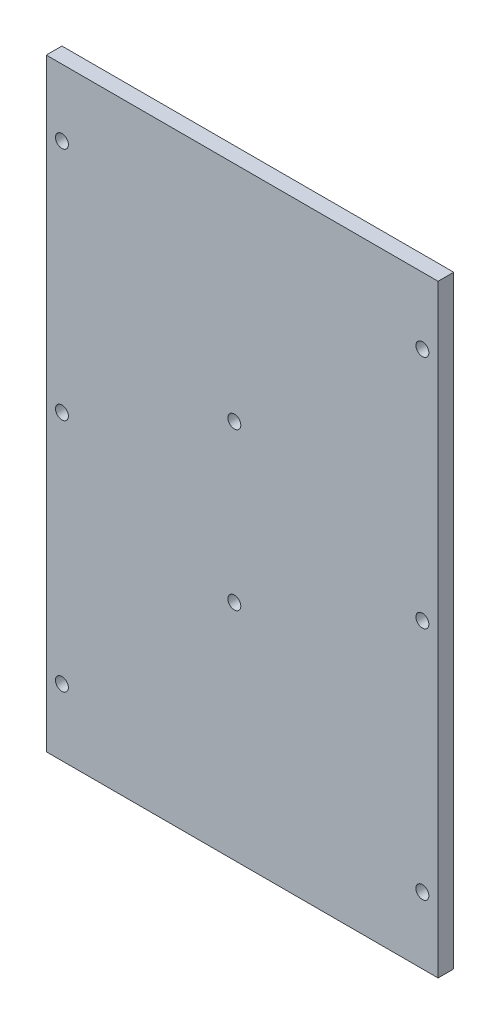
from build123d import *

# Parameters (mm, degrees)
SKETCH1_W                     = 154
SKETCH1_H                     = 100
BOSS_EXTRUDE1_DEPTH           = 4
SKETCH2_R                     = 1.65
CUT_EXTRUDE1_DEPTH            = 184.66273438
SKETCH3_R                     = 7.5
BOSS_EXTRUDE2_DEPTH           = 6
BOSS_EXTRUDE2_DRAFT           = 15
BOSS_EXTRUDE2_PROFILE_2_DEPTH = 6
BOSS_EXTRUDE2_PROFILE_2_DRAFT = 15
BOSS_EXTRUDE2_PROFILE_3_DEPTH = 6
BOSS_EXTRUDE2_PROFILE_3_DRAFT = 15
BOSS_EXTRUDE2_PROFILE_4_DEPTH = 6
BOSS_EXTRUDE2_PROFILE_4_DRAFT = 15
SKETCH4_R                     = 3
CUT_EXTRUDE2_DEPTH            = 1.5


with BuildPart() as part:
    # Sketch1 → Boss-Extrude1 (new body)
    with BuildSketch(Plane(origin=(0, 0, 0), x_dir=(0, 1, 0), z_dir=(0, 0, 1))):
        with Locations((77, 50)):
            Rectangle(SKETCH1_W, SKETCH1_H)
    extrude(amount=BOSS_EXTRUDE1_DEPTH)

    # Sketch2 → Cut-Extrude1 (cut, through all)
    with BuildSketch(Plane(origin=(0, 0, 0), x_dir=(1, 0, 0), z_dir=(0, 0, -1))):
        with Locations(Location((-4, -77, 0), (0, 0, 180))):
            Circle(SKETCH2_R)
        with Locations(Location((-4, -17, 0), (0, 0, 180))):
            Circle(SKETCH2_R)
        with Locations(Location((-4, -137, 0), (0, 0, 180))):
            Circle(SKETCH2_R)
        with Locations(Location((-96, -137, 0), (0, 0, 180))):
            Circle(SKETCH2_R)
        with Locations(Location((-96, -77, 0), (0, 0, 180))):
            Circle(SKETCH2_R)
        with Locations(Location((-96, -17, 0), (0, 0, 180))):
            Circle(SKETCH2_R)
        with Locations(Location((-52, -97, 0), (0, 0, 180))):
            Circle(SKETCH2_R)
        with Locations(Location((-52, -57, 0), (0, 0, 180))):
            Circle(SKETCH2_R)
    extrude(amount=-CUT_EXTRUDE1_DEPTH, mode=Mode.SUBTRACT)


with BuildPart() as boss_extrude2_tool:
    # Sketch3 → Boss-Extrude2 (with draft: the straight prism first)
    with BuildSketch(Plane(origin=(0, 0, 0), x_dir=(1, 0, 0), z_dir=(0, 0, -1))):
        with Locations((-85, -15)):
            Circle(SKETCH3_R)
    extrude(amount=BOSS_EXTRUDE2_DEPTH)
    # Boss-Extrude2: the draft: its side faces are tilted about the plane it starts from
    boss_extrude2_sides = [boss_extrude2_tool.faces().sort_by_distance(p)[0] for p in [
        (-92.5, 15, -3),
    ]]
    draft(boss_extrude2_sides, Plane(origin=(0, 0, 0), x_dir=(1, 0, 0), z_dir=(0, 0, -1)), BOSS_EXTRUDE2_DRAFT)


with BuildPart() as part_1:
    add(part.part)

    # Boss-Extrude2: add boss_extrude2_tool
    add(boss_extrude2_tool.part)


with BuildPart() as boss_extrude2_profile_2_tool:
    # Sketch3 → Boss-Extrude2 profile 2 (with draft: the straight prism first)
    with BuildSketch(Plane(origin=(0, 0, 0), x_dir=(1, 0, 0), z_dir=(0, 0, -1))):
        with Locations((-15, -15)):
            Circle(SKETCH3_R)
    extrude(amount=BOSS_EXTRUDE2_PROFILE_2_DEPTH)
    # Boss-Extrude2 profile 2: the draft: its side faces are tilted about the plane it starts from
    boss_extrude2_profile_2_sides = [boss_extrude2_profile_2_tool.faces().sort_by_distance(p)[0] for p in [
        (-22.5, 15, -3),
    ]]
    draft(boss_extrude2_profile_2_sides, Plane(origin=(0, 0, 0), x_dir=(1, 0, 0), z_dir=(0, 0, -1)), BOSS_EXTRUDE2_PROFILE_2_DRAFT)


with BuildPart() as part_2:
    add(part_1.part)

    # Boss-Extrude2 profile 2: add boss_extrude2_profile_2_tool
    add(boss_extrude2_profile_2_tool.part)


with BuildPart() as boss_extrude2_profile_3_tool:
    # Sketch3 → Boss-Extrude2 profile 3 (with draft: the straight prism first)
    with BuildSketch(Plane(origin=(0, 0, 0), x_dir=(1, 0, 0), z_dir=(0, 0, -1))):
        with Locations((-15, -139)):
            Circle(SKETCH3_R)
    extrude(amount=BOSS_EXTRUDE2_PROFILE_3_DEPTH)
    # Boss-Extrude2 profile 3: the draft: its side faces are tilted about the plane it starts from
    boss_extrude2_profile_3_sides = [boss_extrude2_profile_3_tool.faces().sort_by_distance(p)[0] for p in [
        (-22.5, 139, -3),
    ]]
    draft(boss_extrude2_profile_3_sides, Plane(origin=(0, 0, 0), x_dir=(1, 0, 0), z_dir=(0, 0, -1)), BOSS_EXTRUDE2_PROFILE_3_DRAFT)


with BuildPart() as part_3:
    add(part_2.part)

    # Boss-Extrude2 profile 3: add boss_extrude2_profile_3_tool
    add(boss_extrude2_profile_3_tool.part)


with BuildPart() as boss_extrude2_profile_4_tool:
    # Sketch3 → Boss-Extrude2 profile 4 (with draft: the straight prism first)
    with BuildSketch(Plane(origin=(0, 0, 0), x_dir=(1, 0, 0), z_dir=(0, 0, -1))):
        with Locations((-85, -139)):
            Circle(SKETCH3_R)
    extrude(amount=BOSS_EXTRUDE2_PROFILE_4_DEPTH)
    # Boss-Extrude2 profile 4: the draft: its side faces are tilted about the plane it starts from
    boss_extrude2_profile_4_sides = [boss_extrude2_profile_4_tool.faces().sort_by_distance(p)[0] for p in [
        (-92.5, 139, -3),
    ]]
    draft(boss_extrude2_profile_4_sides, Plane(origin=(0, 0, 0), x_dir=(1, 0, 0), z_dir=(0, 0, -1)), BOSS_EXTRUDE2_PROFILE_4_DRAFT)


with BuildPart() as part_4:
    add(part_3.part)

    # Boss-Extrude2 profile 4: add boss_extrude2_profile_4_tool
    add(boss_extrude2_profile_4_tool.part)

    # Sketch4 → Cut-Extrude2 (cut)
    with BuildSketch(Plane(origin=(0, 0, 0), x_dir=(1, 0, 0), z_dir=(0, 0, -1))):
        with Locations(Location((-96, -17, 0), (0, 0, 180))):
            Circle(SKETCH4_R)
        with Locations(Location((-4, -17, 0), (0, 0, 180))):
            Circle(SKETCH4_R)
        with Locations(Location((-4, -77, 0), (0, 0, 180))):
            Circle(SKETCH4_R)
        with Locations(Location((-96, -77, 0), (0, 0, 180))):
            Circle(SKETCH4_R)
        with Locations(Location((-96, -137, 0), (0, 0, 180))):
            Circle(SKETCH4_R)
        with Locations(Location((-4, -137, 0), (0, 0, 180))):
            Circle(SKETCH4_R)
        with Locations(Location((-52, -57, 0), (0, 0, 180))):
            Circle(SKETCH4_R)
        with Locations(Location((-52, -97, 0), (0, 0, 180))):
            Circle(SKETCH4_R)
    extrude(amount=-CUT_EXTRUDE2_DEPTH, mode=Mode.SUBTRACT)


solid = part_4.part
